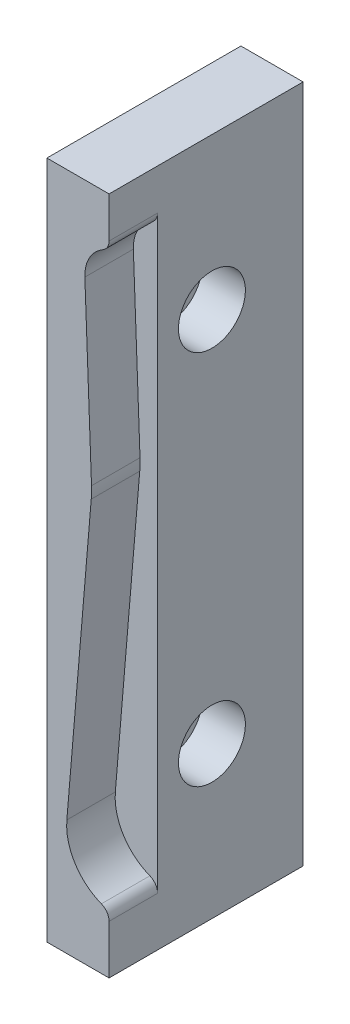
from build123d import *

# Parameters (mm, degrees)
BOSS_EXTRUDE1_DEPTH = 6.35
FILLET1_R           = 3.175
SKETCH3_W           = 16.2814
SKETCH3_H           = 177.8
BOSS_EXTRUDE2_DEPTH = 38.1
SKETCH4_R           = 6.7437
CUT_EXTRUDE1_DEPTH  = 157.034307273
SKETCH5_R           = 8.7641176
CUT_EXTRUDE2_DEPTH  = 11.3284


with BuildPart() as part:
    # Sketch1 → Boss-Extrude1 (new, symmetric)
    with BuildSketch(Plane.XY):
        with BuildLine():
            Line((-3.175, 148.680256121), (-19.4564, 148.680256121))
            Line((-19.4564, 148.680256121), (-19.4564, -29.119743879))
            Line((-19.4564, -29.119743879), (-3.175, -29.119743879))
            Line((-3.175, -29.119743879), (-3.175, -13.930255965))
            ThreePointArc((-3.175, -13.930255965), (-11.533104962, -8.433276125), (-14.237180291, 1.198062439))
            Line((-14.237180291, 1.198062439), (-7.84751395, 77.129690658))
            ThreePointArc((-7.84751395, 77.129690658), (-7.764904905, 78.669797764), (-7.775922348, 80.212079439))
            Line((-7.775922348, 80.212079439), (-9.518300378, 126.6428125))
            ThreePointArc((-9.518300378, 126.6428125), (-7.878891544, 132.352447387), (-3.175, 135.980256121))
            Line((-3.175, 135.980256121), (-3.175, 148.680256121))
        make_face()
    extrude(amount=BOSS_EXTRUDE1_DEPTH, both=True)

    # Fillet1
    fillet1_edges = [part.edges().sort_by_distance(p)[0] for p in [
        (-3.175, 135.980256121, 0),
        (-3.175, -13.930255965, 0),
    ]]
    fillet(fillet1_edges, radius=FILLET1_R)

    # Sketch3 → Boss-Extrude2 (add)
    with BuildSketch(Plane(origin=(0, 0, -6.35), x_dir=(-1, 0, 0), z_dir=(0, 0, -1))):
        with Locations((11.3157, 59.780256121)):
            Rectangle(SKETCH3_W, SKETCH3_H)
    extrude(amount=BOSS_EXTRUDE2_DEPTH)

    # Sketch4 → Cut-Extrude1 (cut, through all)
    with BuildSketch(Plane(origin=(-3.175, 0, 0), x_dir=(0, 0, -1), z_dir=(1, 0, 0))):
        with Locations(Location((20.574, 108.991994121, 0), (0, 0, 90))):
            Circle(SKETCH4_R)
        with Locations(Location((20.574, 10.568518121, 0), (0, 0, 90))):
            Circle(SKETCH4_R)
    extrude(amount=-CUT_EXTRUDE1_DEPTH, mode=Mode.SUBTRACT)

    # Sketch5 → Cut-Extrude2 (cut)
    with BuildSketch(Plane(origin=(-3.175, 0, 0), x_dir=(0, 0, -1), z_dir=(1, 0, 0))):
        with Locations(Location((20.574, 108.991994121, 0), (0, 0, 90))):
            Circle(SKETCH5_R)
        with Locations(Location((20.574, 10.568518121, 0), (0, 0, 90))):
            Circle(SKETCH5_R)
    extrude(amount=-CUT_EXTRUDE2_DEPTH, mode=Mode.SUBTRACT)


solid = part.part
